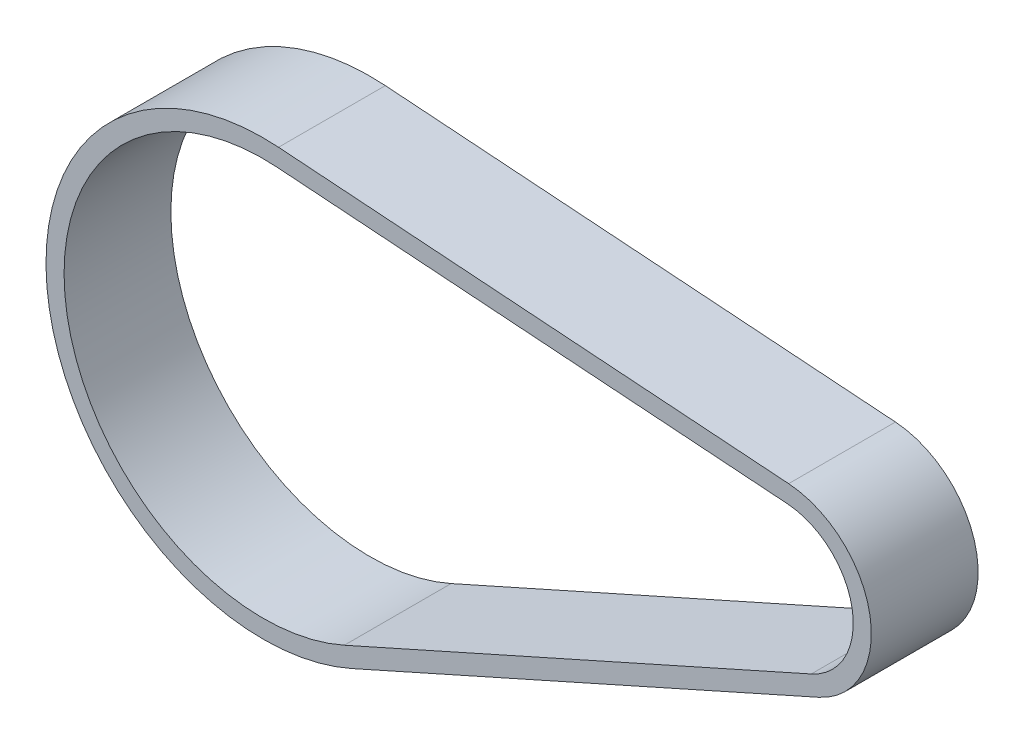
from build123d import *

# Parameters (mm, degrees)
EXTRUDE_THIN1_DEPTH = 15


with BuildPart() as part:
    # Sketch2 → Extrude-Thin1 (new body)
    with BuildSketch(Plane.XY):
        with BuildLine():
            Line((78.022838418, 1.445401421), (12.438691309, -27.848320569))
            ThreePointArc((12.438691309, -27.848320569), (-30.036636467, -5.296269419), (2.163859843, 30.423144324))
            Line((2.163859843, 30.423144324), (73.811841915, 25.327149329))
            ThreePointArc((73.811841915, 25.327149329), (85.235111023, 15.029249777), (78.022838418, 1.445401421))
        make_face()
        with BuildLine():
            Line((76.986960518, 3.764573036), (11.40281341, -25.529148954))
            ThreePointArc((11.40281341, -25.529148954), (-27.535224774, -4.855203048), (1.983656433, 27.889544764))
            Line((1.983656433, 27.889544764), (73.631638505, 22.793549768))
            ThreePointArc((73.631638505, 22.793549768), (82.733699331, 14.588183406), (76.986960518, 3.764573036))
        make_face(mode=Mode.SUBTRACT)
    extrude(amount=-EXTRUDE_THIN1_DEPTH)


solid = part.part
